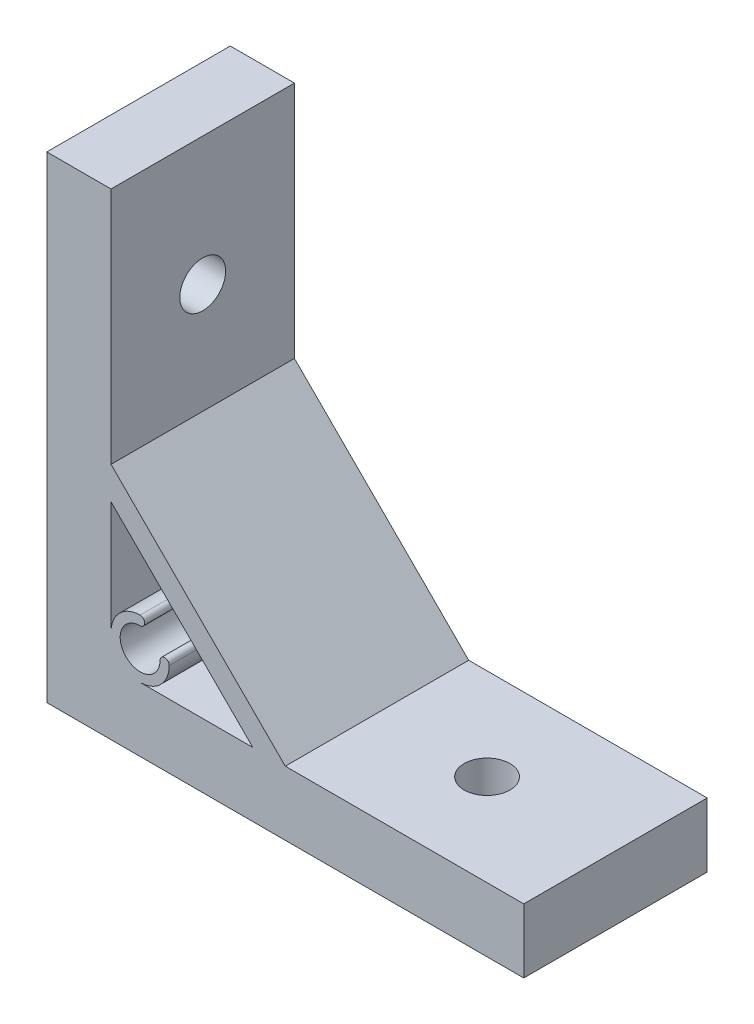
from build123d import *

# Parameters (mm, degrees)
BOSS_EXTRUDE1_DEPTH = 20
CUT_EXTRUDE1_DEPTH  = 7


with BuildPart() as part:
    # Sketch1 → Boss-Extrude1 (new body)
    with BuildSketch(Plane.XY):
        Polygon((0, 52), (0, 0), (52, 0), (52, 7), (26, 7), (7, 26), (7, 52), align=None)
        with BuildLine():
            Line((7, 10.175), (7, 22.464466094))
            Line((7, 22.464466094), (22.464466094, 7))
            Line((22.464466094, 7), (10.175, 7))
            ThreePointArc((10.175, 7), (12.42006403, 7.92993597), (13.35, 10.175))
            ThreePointArc((13.35, 10.175), (12.85, 10.675), (12.35, 10.175))
            ThreePointArc((12.35, 10.175), (8.637042751, 8.637042751), (10.175, 12.35))
            ThreePointArc((10.175, 12.35), (10.675, 12.85), (10.175, 13.35))
            ThreePointArc((10.175, 13.35), (7.92993597, 12.42006403), (7, 10.175))
        make_face(mode=Mode.SUBTRACT)
    extrude(amount=BOSS_EXTRUDE1_DEPTH)

    # Sketch2 → Cut-Extrude1 (cut)
    with BuildSketch(Plane(origin=(7, 0, 0), x_dir=(0, 0, -1), z_dir=(1, 0, 0))):
        with BuildLine():
            ThreePointArc((-7.5, 38), (-8.232233047, 39.767766953), (-10, 40.5))
            Line((-10, 40.5), (-10, 35.5))
            ThreePointArc((-10, 35.5), (-8.232233047, 36.232233047), (-7.5, 38))
        make_face()
        with BuildLine():
            Line((-10, 35.5), (-10, 40.5))
            ThreePointArc((-10, 40.5), (-12.5, 38), (-10, 35.5))
        make_face()
    cut_extrude1 = extrude(amount=-CUT_EXTRUDE1_DEPTH, mode=Mode.SUBTRACT)

    # Mirror4: Cut-Extrude1 across plane
    add(cut_extrude1.mirror(Plane(origin=(0, 0, 0), x_dir=(0, 0, 1), z_dir=(0.7071067811865438, -0.7071067811865512, 0))), mode=Mode.SUBTRACT)


solid = part.part
